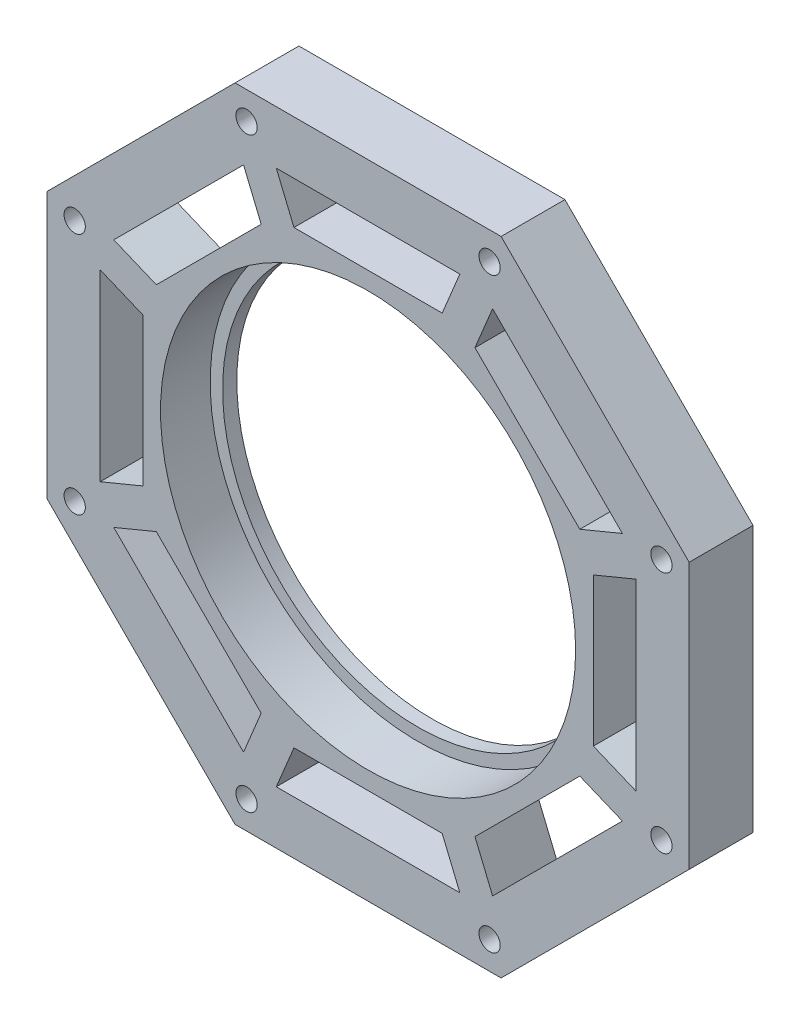
from build123d import *

# Parameters (mm, degrees)
SKETCH1_R           = 27.5
BOSS_EXTRUDE1_DEPTH = 2
SKETCH2_R           = 29.25
BOSS_EXTRUDE2_DEPTH = 7
SKETCH3_R           = 1.5
CUT_EXTRUDE1_DEPTH  = 65.622944842
CIRPATTERN1_COUNT   = 8
CUT_EXTRUDE2_DEPTH  = 65.622944842
CIRPATTERN2_COUNT   = 8


with BuildPart() as part:
    # Sketch1 → Boss-Extrude1 (new body)
    with BuildSketch(Plane.XY):
        Polygon((-45.25, -18.743163697), (-45.25, 18.743163697), (-18.743163697, 45.25), (18.743163697, 45.25), (45.25, 18.743163697), (45.25, -18.743163697), (18.743163697, -45.25), (-18.743163697, -45.25), align=None)
        Circle(SKETCH1_R, mode=Mode.SUBTRACT)
    extrude(amount=BOSS_EXTRUDE1_DEPTH)

    # Sketch2 → Boss-Extrude2 (add)
    with BuildSketch(Plane.XY.offset(2)):
        Polygon((18.743163697, 45.25), (-18.743163697, 45.25), (-45.25, 18.743163697), (-45.25, -18.743163697), (-18.743163697, -45.25), (18.743163697, -45.25), (45.25, -18.743163697), (45.25, 18.743163697), align=None)
        Circle(SKETCH2_R, mode=Mode.SUBTRACT)
    extrude(amount=BOSS_EXTRUDE2_DEPTH)

    # Sketch3 → Cut-Extrude1 (cut, through all)
    with BuildSketch(Plane(origin=(0, 0, 0), x_dir=(-1, 0, 0), z_dir=(0, 0, -1))):
        with Locations((17.125083598, 41.34360908)):
            Circle(SKETCH3_R)
    cut_extrude1 = extrude(amount=-CUT_EXTRUDE1_DEPTH, mode=Mode.SUBTRACT)

    # CirPattern1: Cut-Extrude1 ×8 about axis
    cirpattern1_axis = Axis((0, 0, 0), (0, 0, 1))
    for i in range(1, CIRPATTERN1_COUNT):
        add(cut_extrude1.rotate(cirpattern1_axis, i * 360 / CIRPATTERN1_COUNT), mode=Mode.SUBTRACT)

    # Sketch6 → Cut-Extrude2 (cut, through all)
    with BuildSketch(Plane.XY.offset(9)):
        Polygon((-10.445300105, 31.75), (10.445300105, 31.75), (12.930581479, 37.75), (-12.930581479, 37.75), align=None)
    cut_extrude2 = extrude(amount=-CUT_EXTRUDE2_DEPTH, mode=Mode.SUBTRACT)

    # CirPattern2: Cut-Extrude2 ×8 about axis
    cirpattern2_axis = Axis((0, 0, 0), (0, 0, 1))
    for i in range(1, CIRPATTERN2_COUNT):
        add(cut_extrude2.rotate(cirpattern2_axis, i * 360 / CIRPATTERN2_COUNT), mode=Mode.SUBTRACT)


solid = part.part
